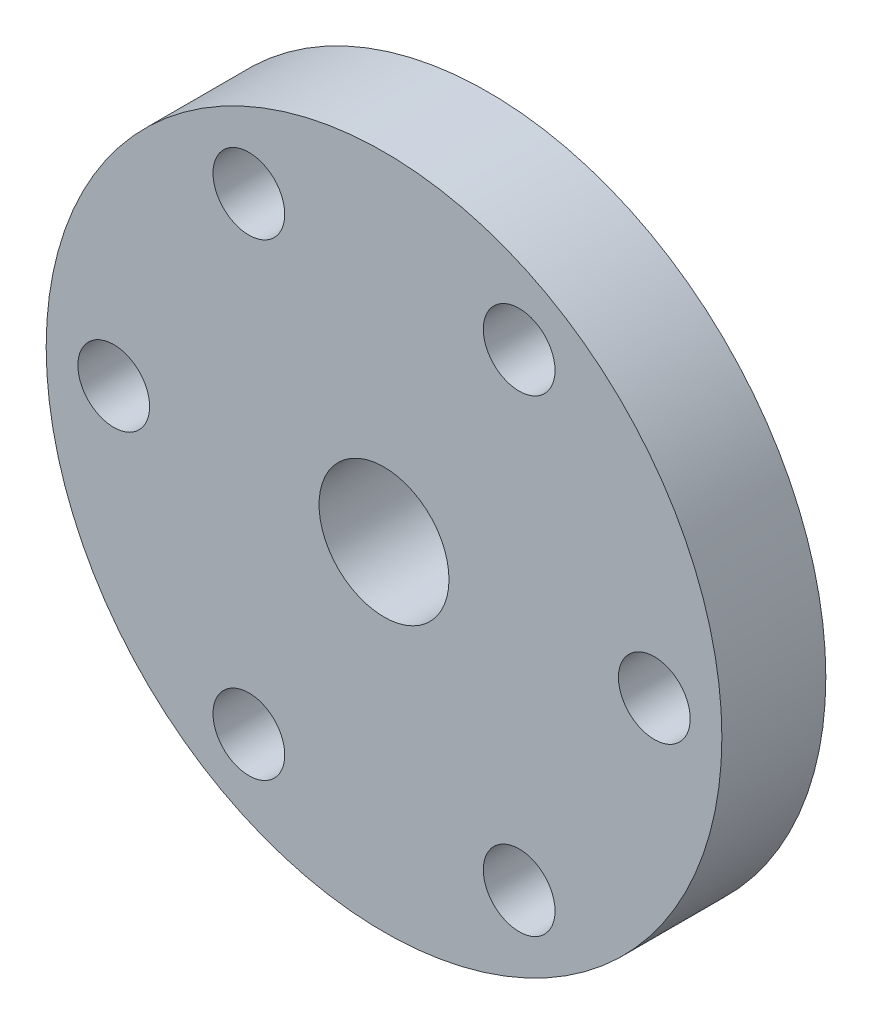
from build123d import *

# Parameters (mm, degrees)
SKETCH1_R           = 16.51
BOSS_EXTRUDE1_DEPTH = 5.08
SKETCH2_R           = 3.175
CUT_EXTRUDE1_DEPTH  = 5.08
SKETCH3_R           = 1.7526
CUT_EXTRUDE2_DEPTH  = 5.08
CIRPATTERN1_COUNT   = 6


with BuildPart() as part:
    # Sketch1 → Boss-Extrude1 (new body)
    with BuildSketch(Plane.XY):
        Circle(SKETCH1_R)
    extrude(amount=BOSS_EXTRUDE1_DEPTH)

    # Sketch2 → Cut-Extrude1 (cut)
    with BuildSketch(Plane.XY.offset(5.08)):
        Circle(SKETCH2_R)
    extrude(amount=-CUT_EXTRUDE1_DEPTH, mode=Mode.SUBTRACT)

    # Sketch3 → Cut-Extrude2 (cut)
    with BuildSketch(Plane.XY.offset(5.08)):
        with Locations((-13.208, 0)):
            Circle(SKETCH3_R)
    cut_extrude2 = extrude(amount=-CUT_EXTRUDE2_DEPTH, mode=Mode.SUBTRACT)

    # CirPattern1: Cut-Extrude2 ×6 about axis
    cirpattern1_axis = Axis((0, 0, 0), (0, 0, 1))
    for i in range(1, CIRPATTERN1_COUNT):
        add(cut_extrude2.rotate(cirpattern1_axis, i * 360 / CIRPATTERN1_COUNT), mode=Mode.SUBTRACT)


solid = part.part
